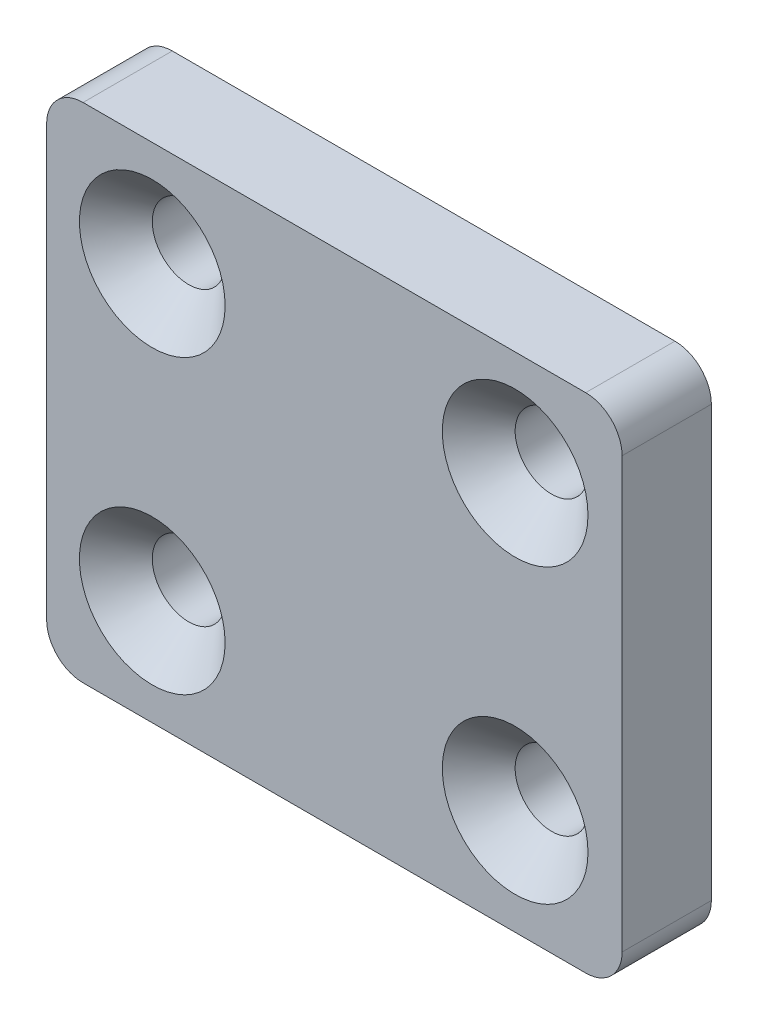
from build123d import *

# Parameters (mm, degrees)
EXTRUDE_1_DEPTH          = 2.45
CUT_EXTRUDE_1_DEPTH      = 3.1
CUT_EXTRUDE_1_DEPTH_BACK = 3.1
SKETCH_4_R               = 1
CUT_EXTRUDE_2_DEPTH      = 6.1
CHAMFER_1_SIZE           = 1


with BuildPart() as part:
    # 草图1 → 凸台-拉伸1 (new body)
    with BuildSketch(Plane.XY):
        with BuildLine():
            Line((-6.9, 6.9), (6.9, 6.9))
            ThreePointArc((6.9, 6.9), (7.607106781, 6.607106781), (7.9, 5.9))
            Line((7.9, 5.9), (7.9, -5.9))
            ThreePointArc((7.9, -5.9), (7.607106781, -6.607106781), (6.9, -6.9))
            Line((6.9, -6.9), (-6.9, -6.9))
            ThreePointArc((-6.9, -6.9), (-7.607106781, -6.607106781), (-7.9, -5.9))
            Line((-7.9, -5.9), (-7.9, 5.9))
            ThreePointArc((-7.9, 5.9), (-7.607106781, 6.607106781), (-6.9, 6.9))
        make_face()
    extrude(amount=EXTRUDE_1_DEPTH)

    # 草图3 → 切除-拉伸1 (cut, two sides: drawn at the far end of the back side and taken through both)
    with BuildSketch(Plane(origin=(0, 0, 0), x_dir=(0, 0, -1), z_dir=(1, 0, 0)).offset(-CUT_EXTRUDE_1_DEPTH_BACK)):
        with BuildLine():
            Line((0.008677119, -0.72827251), (0.008677119, 0.77172749))
            ThreePointArc((0.008677119, 0.77172749), (-0.741322881, 0.02172749), (0.008677119, -0.72827251))
        make_face()
        with BuildLine():
            Line((0.008677119, -6.72827251), (0.008677119, -5.22827251))
            ThreePointArc((0.008677119, -5.22827251), (-0.741322881, -5.97827251), (0.008677119, -6.72827251))
        make_face()
        with BuildLine():
            Line((0.008677119, -4.72827251), (0.008677119, -3.22827251))
            ThreePointArc((0.008677119, -3.22827251), (-0.741322881, -3.97827251), (0.008677119, -4.72827251))
        make_face()
        with BuildLine():
            Line((0.008677119, -2.72827251), (0.008677119, -1.22827251))
            ThreePointArc((0.008677119, -1.22827251), (-0.741322881, -1.97827251), (0.008677119, -2.72827251))
        make_face()
        with BuildLine():
            Line((0.008677119, 1.27172749), (0.008677119, 2.77172749))
            ThreePointArc((0.008677119, 2.77172749), (-0.741322881, 2.02172749), (0.008677119, 1.27172749))
        make_face()
        with BuildLine():
            Line((0.008677119, 3.27172749), (0.008677119, 4.77172749))
            ThreePointArc((0.008677119, 4.77172749), (-0.741322881, 4.02172749), (0.008677119, 3.27172749))
        make_face()
        with BuildLine():
            Line((0.008677119, 5.27172749), (0.008677119, 6.77172749))
            ThreePointArc((0.008677119, 6.77172749), (-0.741322881, 6.02172749), (0.008677119, 5.27172749))
        make_face()
    extrude(amount=CUT_EXTRUDE_1_DEPTH + CUT_EXTRUDE_1_DEPTH_BACK, mode=Mode.SUBTRACT)

    # 草图4 → 切除-拉伸2 (cut)
    with BuildSketch(Plane.XY.offset(2.45)):
        with Locations((-5, -4)):
            Circle(SKETCH_4_R)
        with Locations((4.96323916, -4)):
            Circle(SKETCH_4_R)
        with Locations((4.96323916, 4.01838042)):
            Circle(SKETCH_4_R)
        with Locations((-5, 4.01838042)):
            Circle(SKETCH_4_R)
    extrude(amount=-CUT_EXTRUDE_2_DEPTH, mode=Mode.SUBTRACT)

    # 倒角1
    chamfer_1_edges = [part.edges().sort_by_distance(p)[0] for p in [
        (-6, 4.01838042, 2.45),
        (3.96323916, 4.01838042, 2.45),
        (3.96323916, -4, 2.45),
        (-6, -4, 2.45),
    ]]
    chamfer(chamfer_1_edges, length=CHAMFER_1_SIZE)


solid = part.part
